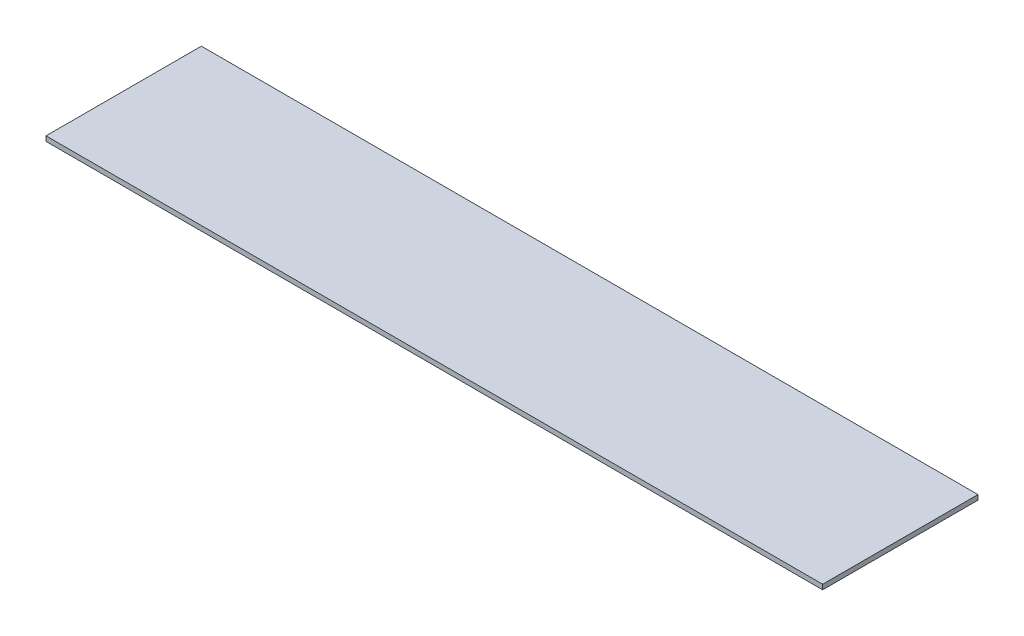
from build123d import *

# Parameters (mm, degrees)
SKETCH1_W           = 508
SKETCH1_H           = 101.6
BOSS_EXTRUDE1_DEPTH = 1.5875


with BuildPart() as part:
    # Sketch1 → Boss-Extrude1 (new, symmetric)
    with BuildSketch(Plane(origin=(0, 0, 0), x_dir=(1, 0, 0), z_dir=(0, 1, 0))):
        Rectangle(SKETCH1_W, SKETCH1_H)
    extrude(amount=BOSS_EXTRUDE1_DEPTH, both=True)


solid = part.part
